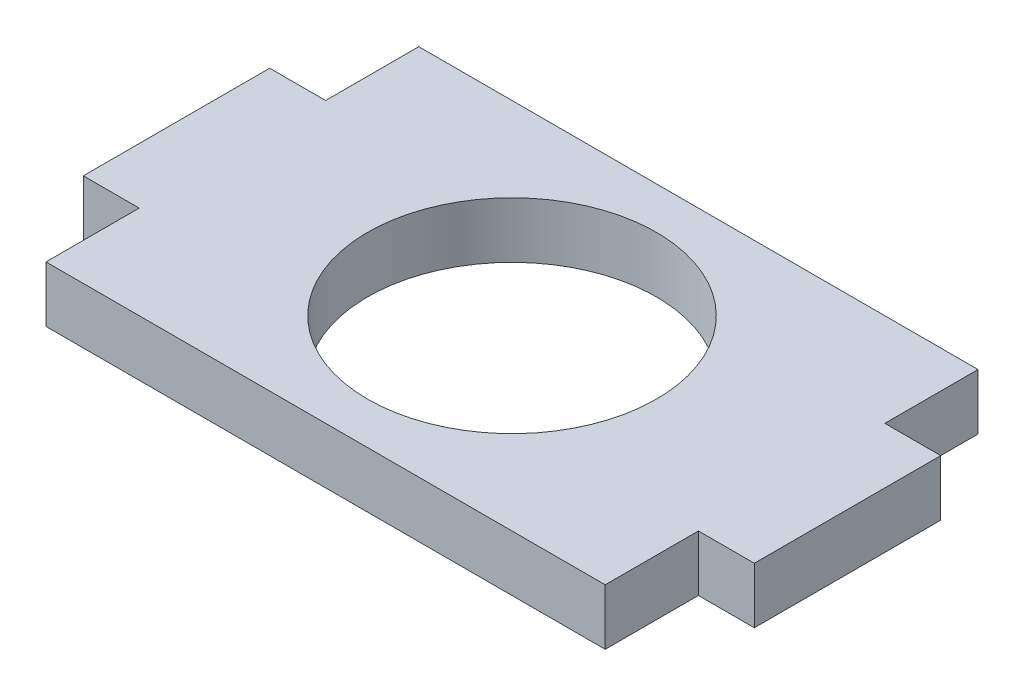
from build123d import *

# Parameters (mm, degrees)
CROQUIS1_R              = 7.75
SALIENTE_EXTRUIR1_DEPTH = 3


with BuildPart() as part:
    # Croquis1 → Saliente-Extruir1 (new body)
    with BuildSketch(Plane(origin=(0, 0, 0), x_dir=(1, 0, 0), z_dir=(0, 1, 0))):
        Polygon((0, -5), (0, 5), (3, 5), (3, 10), (33, 10), (33, 5), (36, 5), (36, -5), (33, -5), (33, -10), (3, -10), (3, -5), align=None)
        with Locations(Location((18, 0, 0), (0, 0, 270))):
            Circle(CROQUIS1_R, mode=Mode.SUBTRACT)
    extrude(amount=SALIENTE_EXTRUIR1_DEPTH)


solid = part.part
